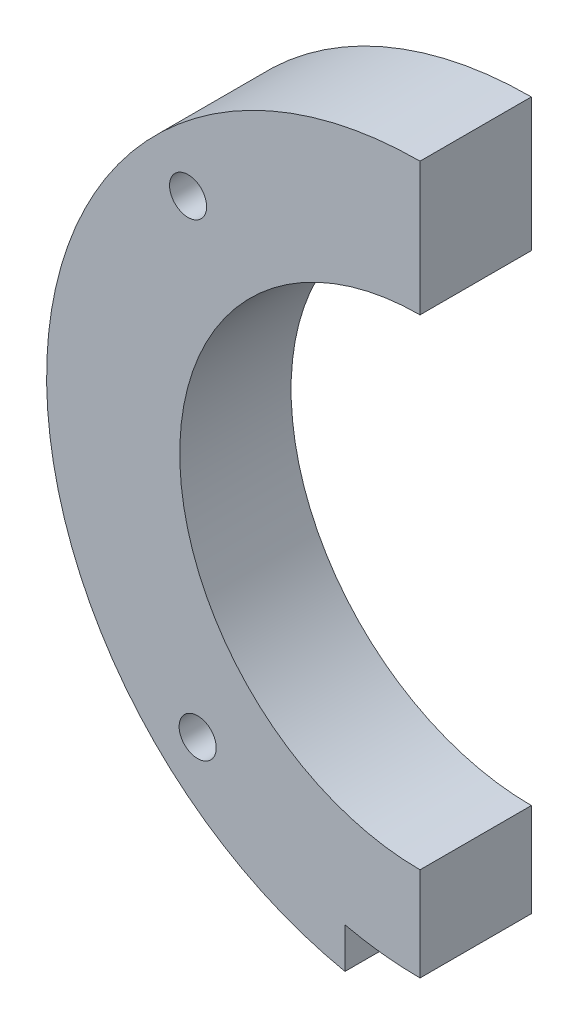
from build123d import *

# Parameters (mm, degrees)
BOSS_EXTRUDE1_DEPTH = 12
SKETCH2_R           = 2
CUT_EXTRUDE1_DEPTH  = 20


with BuildPart() as part:
    # Sketch1 → Boss-Extrude1 (new body)
    with BuildSketch(Plane.XY):
        with BuildLine():
            Line((27, 10.648423286), (27, 15))
            ThreePointArc((27, 15), (31.017062028, 14.31079961), (35.086282243, 14.08008038))
            Line((35.086282243, 14.08008038), (35.086282243, 24.18008038))
            ThreePointArc((35.086282243, 24.18008038), (9.186282243, 50.08008038), (35.086282243, 75.98008038))
            Line((35.086282243, 75.98008038), (35.086282243, 90.332329282))
            ThreePointArc((35.086282243, 90.332329282), (-4.960293251, 54.143986489), (27, 10.648423286))
        make_face()
    extrude(amount=BOSS_EXTRUDE1_DEPTH)

    # Sketch2 → Cut-Extrude1 (cut)
    with BuildSketch(Plane.XY.offset(12)):
        with Locations((10.086282243, 74.574977808)):
            Circle(SKETCH2_R)
        with Locations((11.117766586, 24.574977808)):
            Circle(SKETCH2_R)
    extrude(amount=-CUT_EXTRUDE1_DEPTH, mode=Mode.SUBTRACT)


solid = part.part
